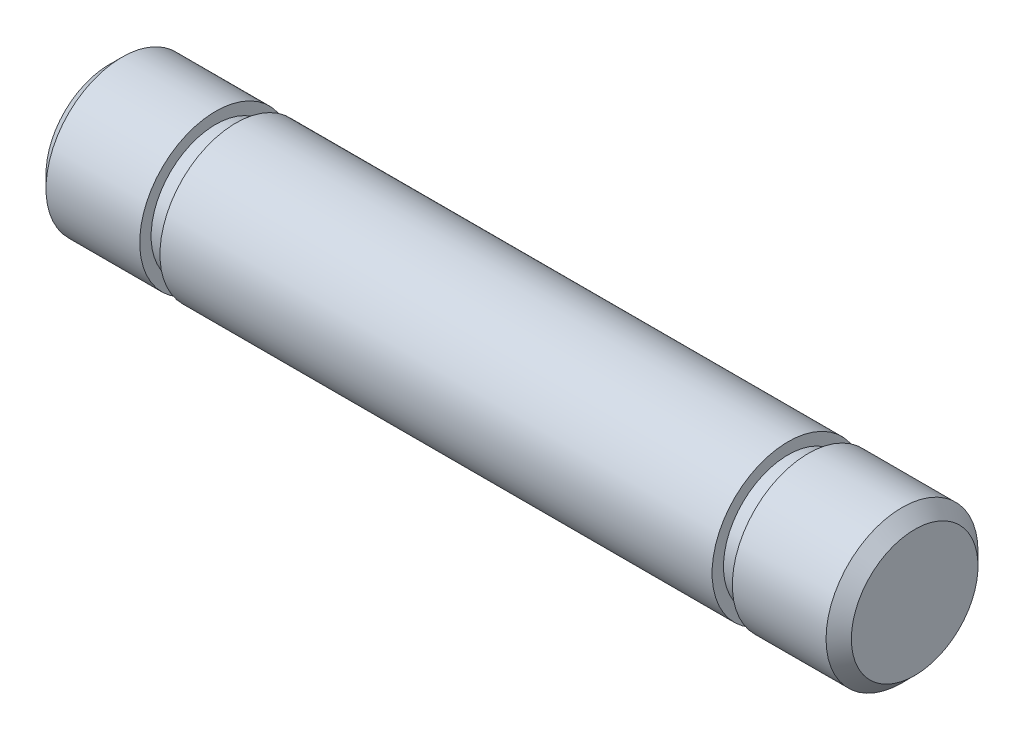
from build123d import *

# Parameters (mm, degrees)
CHAFL_N1_SIZE = 0.5


with BuildPart() as part:
    # Croquis1 → Revolución1 (revolve)
    with BuildSketch(Plane(origin=(0, 0, 0), x_dir=(-1, 0, 0), z_dir=(0, 1, 0)), mode=Mode.PRIVATE) as revoluci_n1_sk:
        Polygon((-10.9, 3), (10.9, 3), (10.9, 2.55), (11.7, 2.55), (11.7, 3), (15.9, 3), (15.9, 0), (-15.9, 0), (-15.9, 3), (-11.7, 3), (-11.7, 2.55), (-10.9, 2.55), align=None)
    revolve(revoluci_n1_sk.sketch.rotate(Axis((15.9, 0, 0), (-1, 0, 0)), 180), axis=Axis((15.9, 0, 0), (-1, 0, 0)))

    # Chaflán1
    chafl_n1_edges = [part.edges().sort_by_distance(p)[0] for p in [
        (-15.9, 0, 3),
        (15.9, 0, 3),
    ]]
    chamfer(chafl_n1_edges, length=CHAFL_N1_SIZE)


solid = part.part
